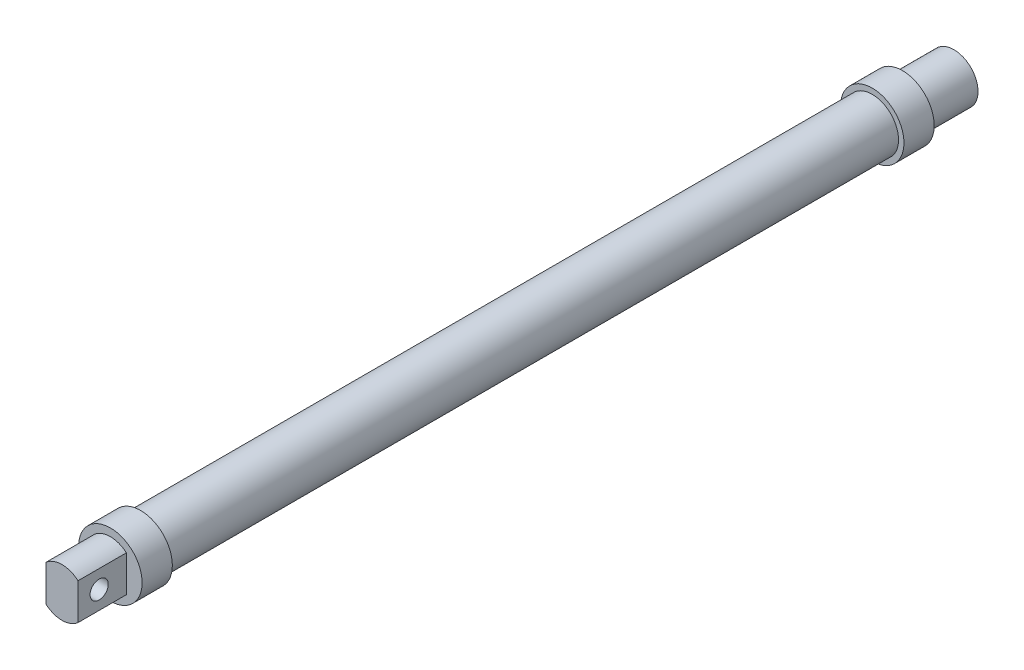
from build123d import *

# Parameters (mm, degrees)
SKETCH1_R           = 10.5
BOSS_EXTRUDE1_DEPTH = 10
SKETCH2_W           = 10.583005244
SKETCH2_H           = 12
BOSS_EXTRUDE2_DEPTH = 16
CUT_EXTRUDE1_REACH  = 34.181
SKETCH3_R           = 3
SKETCH4_R           = 8.7
BOSS_EXTRUDE3_DEPTH = 242
BOSS_EXTRUDE4_START = 10
SKETCH5_R           = 10.5
BOSS_EXTRUDE4_DEPTH = 10
BOSS_EXTRUDE5_START = 17
SKETCH6_R           = 8
BOSS_EXTRUDE5_DEPTH = 17
SKETCH7_R           = 3
CUT_EXTRUDE2_DEPTH  = 201


with BuildPart() as part:
    # Sketch1 → Boss-Extrude1 (new body)
    with BuildSketch(Plane.XY):
        Circle(SKETCH1_R)
    extrude(amount=BOSS_EXTRUDE1_DEPTH)

    # Sketch2 → Boss-Extrude2 (add)
    with BuildSketch(Plane.XY.offset(10)):
        Rectangle(SKETCH2_W, SKETCH2_H)
        with BuildLine():
            ThreePointArc((5.291502622, 6), (0, 8), (-5.291502622, 6))
            Line((-5.291502622, 6), (5.291502622, 6))
        make_face()
        with BuildLine():
            Line((5.291502622, -6), (-5.291502622, -6))
            ThreePointArc((-5.291502622, -6), (0, -8), (5.291502622, -6))
        make_face()
    extrude(amount=BOSS_EXTRUDE2_DEPTH)

    # Sketch3 → Cut-Extrude1 (cut, up to next)
    with BuildSketch(Plane(origin=(5.291502622, 0, 0), x_dir=(0, 0, -1), z_dir=(1, 0, 0)), mode=Mode.PRIVATE) as cut_extrude1_sk1:
        with Locations((-19, 0)):
            Circle(SKETCH3_R)
    cut_extrude1_tool1 = extrude(cut_extrude1_sk1.sketch, amount=-CUT_EXTRUDE1_REACH, mode=Mode.PRIVATE) & part.part
    add(cut_extrude1_tool1.solids().sort_by_distance((5.291503, 0, 19))[0], mode=Mode.SUBTRACT)

    # Sketch4 → Boss-Extrude3 (add)
    with BuildSketch(Plane(origin=(0, 0, 0), x_dir=(-1, 0, 0), z_dir=(0, 0, -1))):
        with Locations(Location((0, 0, 0), (0, 0, 180))):
            Circle(SKETCH4_R)
    extrude(amount=BOSS_EXTRUDE3_DEPTH)

    # Sketch5 → Boss-Extrude4 (add)
    with BuildSketch(Plane(origin=(0, 0, -242), x_dir=(-1, 0, 0), z_dir=(0, 0, -1)).offset(BOSS_EXTRUDE4_START)):
        with Locations(Location((0, 0, 0), (0, 0, 180))):
            Circle(SKETCH5_R)
    extrude(amount=-BOSS_EXTRUDE4_DEPTH)

    # Sketch6 → Boss-Extrude5 (add)
    with BuildSketch(Plane(origin=(0, 0, -252), x_dir=(-1, 0, 0), z_dir=(0, 0, -1)).offset(BOSS_EXTRUDE5_START)):
        Circle(SKETCH6_R)
    extrude(amount=-BOSS_EXTRUDE5_DEPTH)

    # Sketch7 → Cut-Extrude2 (cut)
    with BuildSketch(Plane(origin=(0, 0, -269), x_dir=(-1, 0, 0), z_dir=(0, 0, -1))):
        Circle(SKETCH7_R)
    extrude(amount=-CUT_EXTRUDE2_DEPTH, mode=Mode.SUBTRACT)


solid = part.part
